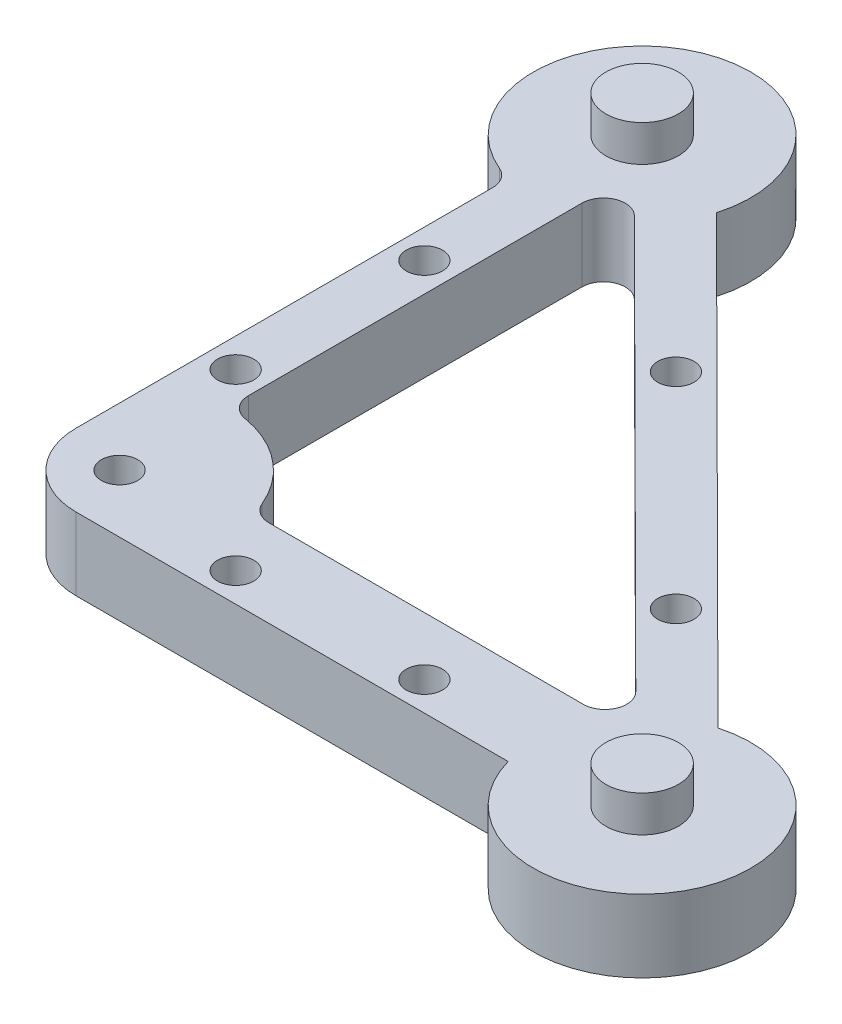
from build123d import *

# Parameters (mm, degrees)
BOSS_EXTRUDE1_DEPTH = 10
SKETCH2_R           = 5
BOSS_EXTRUDE2_DEPTH = 5
SKETCH3_R           = 5
BOSS_EXTRUDE3_DEPTH = 5
SKETCH4_R           = 2.5
CUT_EXTRUDE1_DEPTH  = 111.227038425
SKETCH5_R           = 2.5
CUT_EXTRUDE2_DEPTH  = 111.227038425
SKETCH6_R           = 2.5
CUT_EXTRUDE3_DEPTH  = 111.227038425
SKETCH7_R           = 2.5
CUT_EXTRUDE4_DEPTH  = 111.227038425
SKETCH8_R           = 2.5
CUT_EXTRUDE5_DEPTH  = 111.227038425
CUT_EXTRUDE6_DEPTH  = 111.227038425
FILLET3_R           = 3
SKETCH11_R          = 2.5
CUT_EXTRUDE7_DEPTH  = 111.227038425
SKETCH12_R          = 2.5
CUT_EXTRUDE8_DEPTH  = 111.227038425
FILLET4_R           = 3
FILLET5_R           = 3
FILLET6_R           = 3
FILLET7_R           = 3
FILLET8_R           = 10


with BuildPart() as part:
    # Sketch1 → Boss-Extrude1 (new body)
    with BuildSketch(Plane(origin=(0, 0, 0), x_dir=(1, 0, 0), z_dir=(0, 1, 0))):
        with BuildLine():
            Line((-25.590058181, 75.834237552), (36, 14.456832295))
            ThreePointArc((36, 14.456832295), (53.050951275, -7.394097025), (25.543167705, -4))
            Line((25.543167705, -4), (-44, -4))
            Line((-44, -4), (-44, 65.543167705))
            ThreePointArc((-44, 65.543167705), (-47.31903353, 93.093194728), (-25.590058181, 75.834237552))
        make_face()
    extrude(amount=BOSS_EXTRUDE1_DEPTH)

    # Sketch2 → Boss-Extrude2 (add)
    with BuildSketch(Plane(origin=(0, 10, 0), x_dir=(1, 0, 0), z_dir=(0, 1, 0))):
        with Locations(Location((-40, 80, 0), (0, 0, 270))):
            Circle(SKETCH2_R)
    extrude(amount=BOSS_EXTRUDE2_DEPTH)

    # Sketch3 → Boss-Extrude3 (add)
    with BuildSketch(Plane(origin=(0, 10, 0), x_dir=(1, 0, 0), z_dir=(0, 1, 0))):
        with Locations(Location((40, 0, 0), (0, 0, 270))):
            Circle(SKETCH3_R)
    extrude(amount=BOSS_EXTRUDE3_DEPTH)

    # Sketch4 → Cut-Extrude1 (cut, through all)
    with BuildSketch(Plane(origin=(0, 10, 0), x_dir=(1, 0, 0), z_dir=(0, 1, 0))):
        with Locations(Location((-40, 50, 0), (0, 0, 270))):
            Circle(SKETCH4_R)
    extrude(amount=-CUT_EXTRUDE1_DEPTH, mode=Mode.SUBTRACT)

    # Sketch5 → Cut-Extrude2 (cut, through all)
    with BuildSketch(Plane(origin=(0, 10, 0), x_dir=(1, 0, 0), z_dir=(0, 1, 0))):
        with Locations(Location((-40, 24, 0), (0, 0, 270))):
            Circle(SKETCH5_R)
    extrude(amount=-CUT_EXTRUDE2_DEPTH, mode=Mode.SUBTRACT)

    # Sketch6 → Cut-Extrude3 (cut, through all)
    with BuildSketch(Plane(origin=(0, 10, 0), x_dir=(1, 0, 0), z_dir=(0, 1, 0))):
        with Locations(Location((10, 0, 0), (0, 0, 270))):
            Circle(SKETCH6_R)
    extrude(amount=-CUT_EXTRUDE3_DEPTH, mode=Mode.SUBTRACT)

    # Sketch7 → Cut-Extrude4 (cut, through all)
    with BuildSketch(Plane(origin=(0, 10, 0), x_dir=(1, 0, 0), z_dir=(0, 1, 0))):
        with Locations(Location((-16, 0, 0), (0, 0, 270))):
            Circle(SKETCH7_R)
    extrude(amount=-CUT_EXTRUDE4_DEPTH, mode=Mode.SUBTRACT)

    # Sketch8 → Cut-Extrude5 (cut, through all)
    with BuildSketch(Plane(origin=(0, 10, 0), x_dir=(1, 0, 0), z_dir=(0, 1, 0))):
        with Locations(Location((-36, 4, 0), (0, 0, 270))):
            Circle(SKETCH8_R)
    extrude(amount=-CUT_EXTRUDE5_DEPTH, mode=Mode.SUBTRACT)

    # Sketch10 → Cut-Extrude6 (cut, through all)
    with BuildSketch(Plane(origin=(0, 10, 0), x_dir=(1, 0, 0), z_dir=(0, 1, 0))):
        with BuildLine():
            Line((-36, 74.914042926), (31.145878515, 8))
            Line((31.145878515, 8), (-21.543167705, 8))
            ThreePointArc((-21.543167705, 8), (-26.917048938, 15.937336386), (-36, 19))
            Line((-36, 19), (-36, 74.914042926))
        make_face()
    extrude(amount=-CUT_EXTRUDE6_DEPTH, mode=Mode.SUBTRACT)

    # Fillet3
    fillet3_edges = [part.edges().sort_by_distance(p)[0] for p in [
        (-44, 5, -65.543167705),
    ]]
    fillet(fillet3_edges, radius=FILLET3_R)

    # Sketch11 → Cut-Extrude7 (cut, through all)
    with BuildSketch(Plane(origin=(0, 10, 0), x_dir=(1, 0, 0), z_dir=(0, 1, 0))):
        with Locations(Location((-9.398144918, 54.051141856, 0), (0, 0, 270))):
            Circle(SKETCH11_R)
    extrude(amount=-CUT_EXTRUDE7_DEPTH, mode=Mode.SUBTRACT)

    # Sketch12 → Cut-Extrude8 (cut, through all)
    with BuildSketch(Plane(origin=(0, 10, 0), x_dir=(1, 0, 0), z_dir=(0, 1, 0))):
        with Locations(Location((18.886126329, 25.766870608, 0), (0, 0, 270))):
            Circle(SKETCH12_R)
    extrude(amount=-CUT_EXTRUDE8_DEPTH, mode=Mode.SUBTRACT)

    # Fillet4
    fillet4_edges = [part.edges().sort_by_distance(p)[0] for p in [
        (-36, 5, -74.914042926),
    ]]
    fillet(fillet4_edges, radius=FILLET4_R)

    # Fillet5
    fillet5_edges = [part.edges().sort_by_distance(p)[0] for p in [
        (31.145878515, 5, -8),
    ]]
    fillet(fillet5_edges, radius=FILLET5_R)

    # Fillet6
    fillet6_edges = [part.edges().sort_by_distance(p)[0] for p in [
        (-36, 5, -19),
    ]]
    fillet(fillet6_edges, radius=FILLET6_R)

    # Fillet7
    fillet7_edges = [part.edges().sort_by_distance(p)[0] for p in [
        (-21.543167705, 5, -8),
    ]]
    fillet(fillet7_edges, radius=FILLET7_R)

    # Fillet8
    fillet8_edges = [part.edges().sort_by_distance(p)[0] for p in [
        (-44, 5, 4),
    ]]
    fillet(fillet8_edges, radius=FILLET8_R)


solid = part.part
